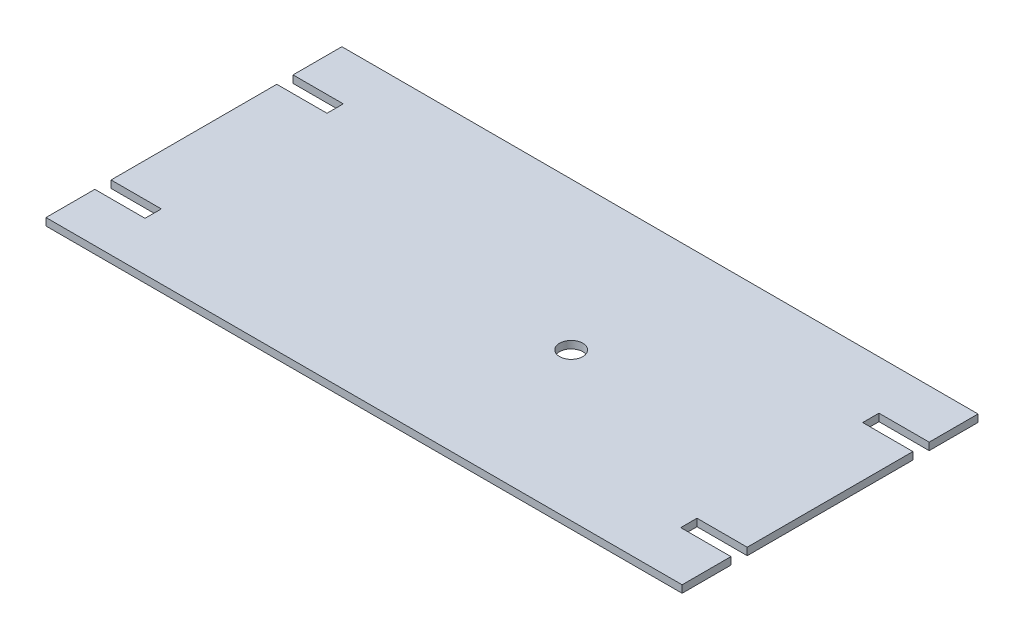
from build123d import *

# Parameters (mm, degrees)
BOSS_EXTRUDE1_DEPTH = 5
SKETCH2_R           = 7.85
CUT_EXTRUDE1_DEPTH  = 238.170824513


with BuildPart() as part:
    # Sketch1 → Boss-Extrude1 (new body)
    with BuildSketch(Plane(origin=(0, 0, 0), x_dir=(1, 0, 0), z_dir=(0, 1, 0))):
        Polygon((-215, -67.002075658), (-215, -100), (215, -100), (215, -67.002075658), (181.053785401, -67.002075658), (181.053785401, -56.002075658), (215, -56.002075658), (215, 56.002075658), (181.053785401, 56.002075658), (181.053785401, 67.002075658), (215, 67.002075658), (215, 100), (-215, 100), (-215, 67.002075658), (-181.053785401, 67.002075658), (-181.053785401, 56.002075658), (-215, 56.002075658), (-215, -56.002075658), (-181.053785401, -56.002075658), (-181.053785401, -67.002075658), align=None)
    extrude(amount=BOSS_EXTRUDE1_DEPTH)

    # Sketch2 → Cut-Extrude1 (cut, through all)
    with BuildSketch(Plane(origin=(0, 5, 0), x_dir=(1, 0, 0), z_dir=(0, 1, 0))):
        with Locations(Location((40, 0, 0), (0, 0, 270))):
            Circle(SKETCH2_R)
    extrude(amount=-CUT_EXTRUDE1_DEPTH, mode=Mode.SUBTRACT)


solid = part.part
